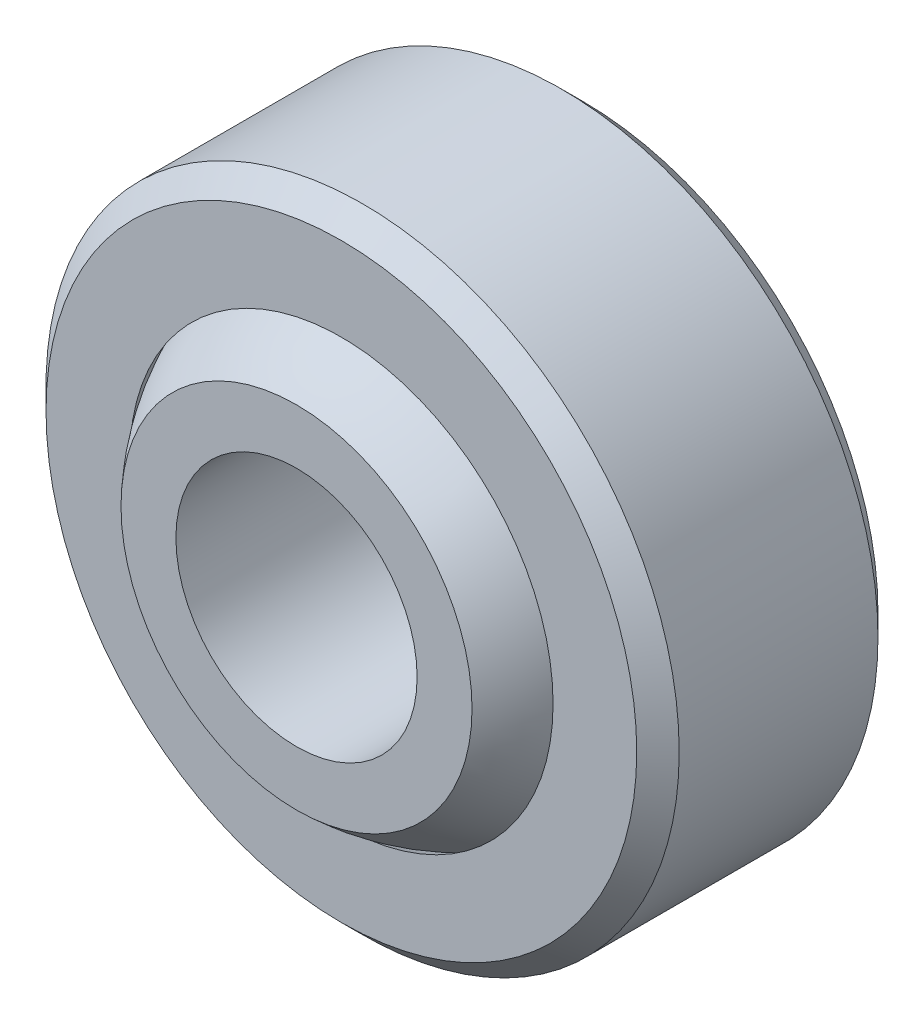
from build123d import *

# Parameters (mm, degrees)
SKETCH1_R               = 8.33374
EXTRUDE1_DEPTH          = 3.175
CUT_EXTRUDE1_DEPTH      = 14.417728087
CUT_EXTRUDE1_DEPTH_BACK = 14.417728087
SKETCH4_R               = 3.175
CUT_EXTRUDE2_DEPTH      = 14.417728087
CUT_EXTRUDE2_DEPTH_BACK = 14.417728087
SKETCH5_W               = 1.143161314
SKETCH5_H               = 16.66748
CHAMFER1_SIZE           = 0.5588


with BuildPart() as part:
    # Sketch1 → Extrude1 (new, symmetric)
    with BuildSketch(Plane.XY):
        Circle(SKETCH1_R)
    extrude(amount=EXTRUDE1_DEPTH, both=True)

    # Sketch2 → Cut-Revolve1 (revolve, cut)
    with BuildSketch(Plane.XY):
        with BuildLine():
            Line((0, 6.4135), (0, -6.4135))
            ThreePointArc((0, -6.4135), (6.4135, 0), (0, 6.4135))
        make_face()
    revolve(axis=Axis((0, 6.4135, 0), (0, 1, 0)), mode=Mode.SUBTRACT)

    # Chamfer1
    chamfer1_edges = [part.edges().sort_by_distance(p)[0] for p in [
        (-8.33374, 0, 3.175),
        (-8.33374, 0, -3.175),
    ]]
    chamfer(chamfer1_edges, length=CHAMFER1_SIZE)


with BuildPart() as body_2:
    # Sketch3 → Revolve1 (revolve)
    with BuildSketch(Plane.XY):
        with BuildLine():
            Line((0, 6.35), (0, -6.35))
            ThreePointArc((0, -6.35), (6.35, 0), (0, 6.35))
        make_face()
    revolve(axis=Axis((0, 6.35, 0), (0, 1, 0)))

    # Sketch4 → Cut-Extrude1 (cut, two sides: drawn at the far end of the back side and taken through both)
    with BuildSketch(Plane.XY.offset(-CUT_EXTRUDE1_DEPTH_BACK)):
        Circle(SKETCH4_R)
    extrude(amount=CUT_EXTRUDE1_DEPTH + CUT_EXTRUDE1_DEPTH_BACK, mode=Mode.SUBTRACT)

    # Sketch5 → Cut-Extrude2 (cut, two sides: drawn at the far end of the back side and taken through both)
    with BuildSketch(Plane(origin=(0, 0, 0), x_dir=(0, 0, -1), z_dir=(1, 0, 0)).offset(-CUT_EXTRUDE2_DEPTH_BACK)):
        with Locations((-4.927680657, 0)):
            Rectangle(SKETCH5_W, SKETCH5_H)
        with Locations((4.927680657, 0)):
            Rectangle(SKETCH5_W, SKETCH5_H)
    extrude(amount=CUT_EXTRUDE2_DEPTH + CUT_EXTRUDE2_DEPTH_BACK, mode=Mode.SUBTRACT)


solid = Compound([part.part, body_2.part])
